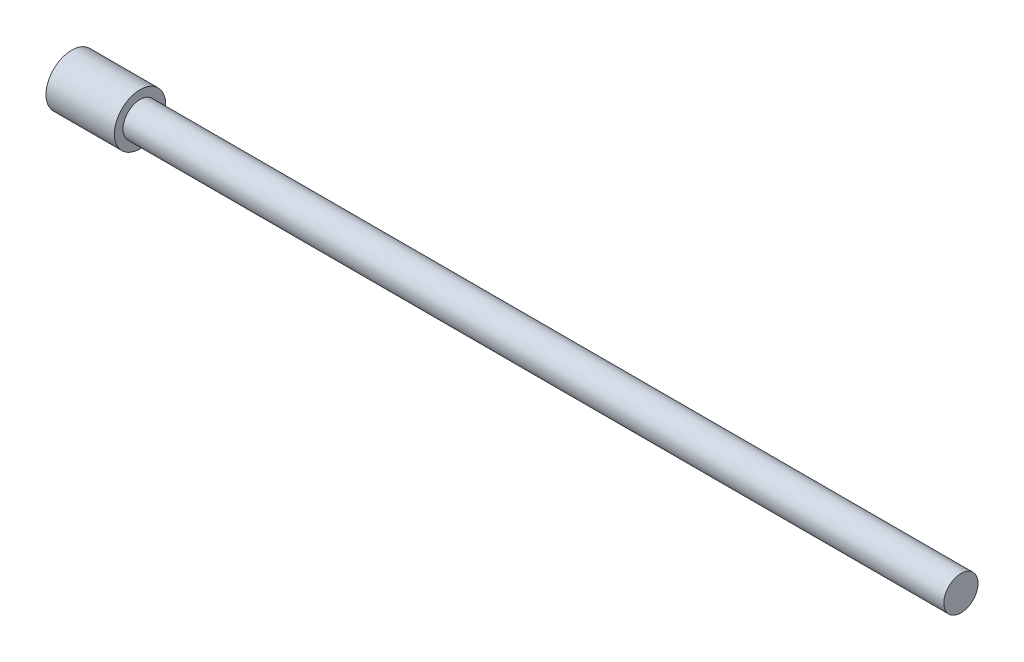
from build123d import *

# Parameters (mm, degrees)
SKETCH1_R           = 6.35
BOSS_EXTRUDE1_DEPTH = 152.4
SKETCH2_R           = 9.525
BOSS_EXTRUDE2_DEPTH = 25.4


with BuildPart() as part:
    # Sketch1 → Boss-Extrude1 (new, symmetric)
    with BuildSketch(Plane(origin=(0, 0, 0), x_dir=(0, 0, -1), z_dir=(1, 0, 0))):
        with Locations(Location((0, 0, 0), (0, 0, 180))):
            Circle(SKETCH1_R)
    extrude(amount=BOSS_EXTRUDE1_DEPTH, both=True)

    # Sketch2 → Boss-Extrude2 (add)
    with BuildSketch(Plane.ZY.offset(152.4)):
        Circle(SKETCH2_R)
    extrude(amount=BOSS_EXTRUDE2_DEPTH)


solid = part.part
